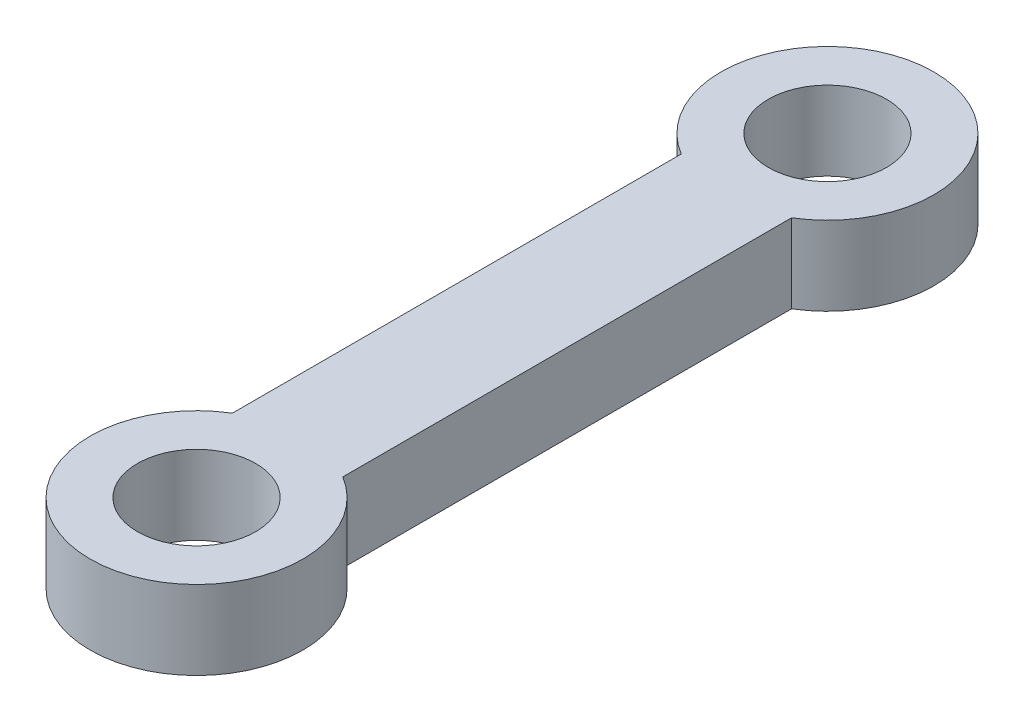
from build123d import *

# Parameters (mm, degrees)
SKETCH_1_R      = 1.5
EXTRUDE_1_DEPTH = 2


with BuildPart() as part:
    # 草图1 → 凸台-拉伸1 (new body)
    with BuildSketch(Plane(origin=(0, 0, 0), x_dir=(1, 0, 0), z_dir=(0, 1, 0))):
        with BuildLine():
            Line((-1.4, -2.308679276), (-1.4, -13.691320724))
            ThreePointArc((-1.4, -13.691320724), (0, -18.7), (1.4, -13.691320724))
            Line((1.4, -13.691320724), (1.4, -2.308679276))
            ThreePointArc((1.4, -2.308679276), (0, 2.7), (-1.4, -2.308679276))
        make_face()
        with Locations(Location((0, 0, 0), (0, 0, 270))):
            Circle(SKETCH_1_R, mode=Mode.SUBTRACT)
        with Locations(Location((0, -16, 0), (0, 0, 270))):
            Circle(SKETCH_1_R, mode=Mode.SUBTRACT)
    extrude(amount=EXTRUDE_1_DEPTH)


solid = part.part
